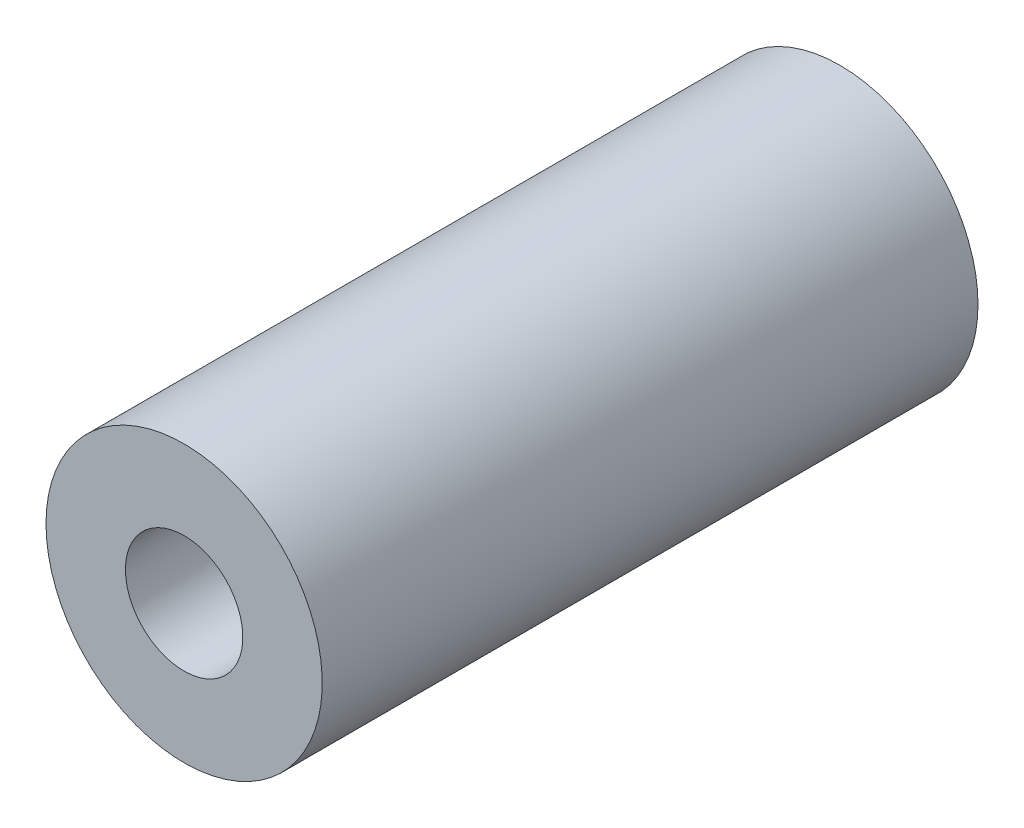
from build123d import *

# Parameters (mm, degrees)
SKETCH1_R           = 2
SKETCH1_R_2         = 0.85
BOSS_EXTRUDE1_DEPTH = 9.495993971


with BuildPart() as part:
    # Sketch1 → Boss-Extrude1 (new body)
    with BuildSketch(Plane.XY):
        with Locations(Location((0, 0, 0), (0, 0, 180))):
            Circle(SKETCH1_R)
        with Locations(Location((0, 0, 0), (0, 0, 180))):
            Circle(SKETCH1_R_2, mode=Mode.SUBTRACT)
    extrude(amount=BOSS_EXTRUDE1_DEPTH)


solid = part.part
